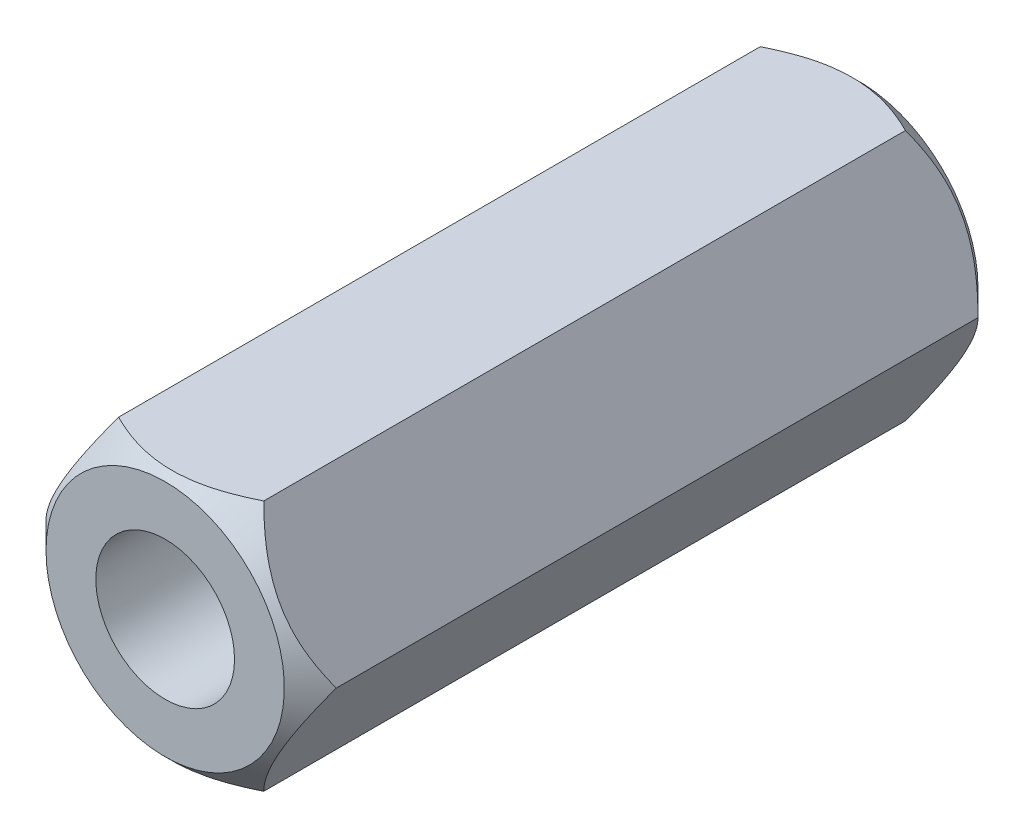
from build123d import *

# Parameters (mm, degrees)
EXTRUDE_1_DEPTH   = 4
HOLE_WIZARD_M21_D = 1.6


with BuildPart() as part:
    # Эскиз1 → Бобышка-Вытянуть1 (new, symmetric)
    with BuildSketch(Plane.XY):
        Polygon((1.674315781, 0), (0.83715789, 1.45), (-0.83715789, 1.45), (-1.674315781, 0), (-0.83715789, -1.45), (0.83715789, -1.45), align=None)
    extrude(amount=EXTRUDE_1_DEPTH, both=True)

    # Отверстие обработанное метчиком M21 (through all)
    with Locations(Plane.XY.offset(4)):
        with Locations((0, 0)):
            Hole(HOLE_WIZARD_M21_D / 2)

    # Эскиз4 → Вырез-Повернуть1 (revolve, cut)
    with BuildSketch(Plane(origin=(0, 0, 0), x_dir=(0, 0, -1), z_dir=(0, 1, 0)), mode=Mode.PRIVATE) as cut_revolve_1_sk:
        Polygon((4, 1.374315781), (3.7, 1.674315781), (4, 1.674315781), align=None)
        Polygon((-4, 1.674315781), (-4, 1.374315781), (-3.7, 1.674315781), align=None)
    revolve(cut_revolve_1_sk.sketch.rotate(Axis((0, 0, -4), (0, 0, 1)), 180), axis=Axis((0, 0, -4), (0, 0, 1)), mode=Mode.SUBTRACT)


solid = part.part
